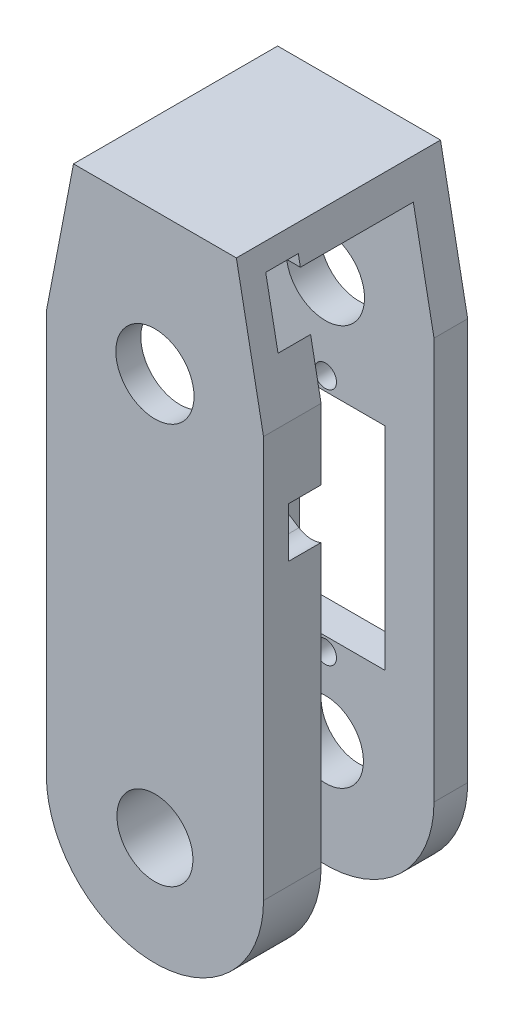
from build123d import *

# Parameters (mm, degrees)
SKETCH1_R           = 4.572
SKETCH1_R_2         = 4.445
BOSS_EXTRUDE1_DEPTH = 6.731
BOSS_EXTRUDE3_START = -13.208
SKETCH1_5_R         = 4.572
SKETCH1_5_R_2       = 1.2954
SKETCH1_5_R_3       = 4.445
SKETCH1_5_W         = 13.97
SKETCH1_5_H         = 24.765
BOSS_EXTRUDE3_DEPTH = 3.937
SKETCH4_R           = 1.7
CUT_EXTRUDE4_DEPTH  = 3.81
BOSS_EXTRUDE5_DEPTH = 16.4211
BOSS_EXTRUDE6_DEPTH = 4.572


with BuildPart() as part:
    # Sketch1 (on Front Plane) → Boss-Extrude1 (new body)
    with BuildSketch(Plane.XY):
        with BuildLine():
            Line((-12.7, 0), (-9.525, 16.51))
            Line((-9.525, 16.51), (9.525, 16.51))
            Line((9.525, 16.51), (12.7, 0))
            Line((12.7, 0), (12.7, -46.99))
            ThreePointArc((12.7, -46.99), (0, -59.69), (-12.7, -46.99))
            Line((-12.7, -46.99), (-12.7, 0))
        make_face()
        Circle(SKETCH1_R, mode=Mode.SUBTRACT)
        with Locations((0, -46.99)):
            Circle(SKETCH1_R_2, mode=Mode.SUBTRACT)
    extrude(amount=BOSS_EXTRUDE1_DEPTH)

    # Sketch4 → Cut-Extrude4 (cut)
    with BuildSketch(Plane(origin=(0, 0, 0), x_dir=(-1, 0, 0), z_dir=(0, 0, -1))):
        with BuildLine():
            Line((12.7, -14.099075092), (12.7, 0))
            Line((12.7, 0), (11.302104433, 7.269056948))
            Line((11.302104433, 7.269056948), (10.037418608, 13.84542324))
            Line((10.037418608, 13.84542324), (1.021082558, 8.023816422))
            ThreePointArc((1.021082558, 8.023816422), (0, 7.408645479), (-1.021082558, 8.023816422))
            Line((-1.021082558, 8.023816422), (-10.037418608, 13.84542324))
            Line((-10.037418608, 13.84542324), (-11.47556666, 6.367053366))
            Line((-11.47556666, 6.367053366), (-8.023816422, 1.021082558))
            ThreePointArc((-8.023816422, 1.021082558), (-7.408645479, 0), (-8.023816422, -1.021082558))
            Line((-8.023816422, -1.021082558), (-12.7, -8.263420264))
            Line((-12.7, -8.263420264), (-12.7, -14.099075092))
            ThreePointArc((-12.7, -14.099075092), (-11.380658922, -14.323016968), (-10.113003756, -13.894226547))
            Line((-10.113003756, -13.894226547), (-1.021082558, -8.023816422))
            ThreePointArc((-1.021082558, -8.023816422), (0, -7.408645479), (1.021082558, -8.023816422))
            Line((1.021082558, -8.023816422), (10.113003756, -13.894226547))
            ThreePointArc((10.113003756, -13.894226547), (11.380658922, -14.323016968), (12.7, -14.099075092))
        make_face()
        Circle(SKETCH4_R, mode=Mode.SUBTRACT)
    extrude(amount=-CUT_EXTRUDE4_DEPTH, mode=Mode.SUBTRACT)



with BuildPart() as body_2:
    # Sketch1<5> → Boss-Extrude3 (new body)
    with BuildSketch(Plane.XY.offset(BOSS_EXTRUDE3_START)):
        with BuildLine():
            Line((-12.7, 0), (-9.525, 16.51))
            Line((-9.525, 16.51), (9.525, 16.51))
            Line((9.525, 16.51), (12.7, 0))
            Line((12.7, 0), (12.7, -46.99))
            ThreePointArc((12.7, -46.99), (0, -59.69), (-12.7, -46.99))
            Line((-12.7, -46.99), (-12.7, 0))
        make_face()
        Circle(SKETCH1_5_R, mode=Mode.SUBTRACT)
        with Locations((0, -10.16)):
            Circle(SKETCH1_5_R_2, mode=Mode.SUBTRACT)
        with Locations((0, -38.1)):
            Circle(SKETCH1_5_R_2, mode=Mode.SUBTRACT)
        with Locations((0, -46.99)):
            Circle(SKETCH1_5_R_3, mode=Mode.SUBTRACT)
        with Locations((0, -24.13)):
            Rectangle(SKETCH1_5_W, SKETCH1_5_H, mode=Mode.SUBTRACT)
    extrude(amount=-BOSS_EXTRUDE3_DEPTH)


with BuildPart() as part_1:
    add(part.part)

    add(body_2.part)  # Boss-Extrude5 merges body 2
    # Sketch5 → Boss-Extrude5 (add)
    with BuildSketch(Plane(origin=(0, 0, 0), x_dir=(-1, 0, 0), z_dir=(0, 0, -1))):
        Polygon((-9.525, 16.51), (9.525, 16.51), (10.282115385, 12.573), (-10.282115385, 12.573), align=None)
    extrude(amount=BOSS_EXTRUDE5_DEPTH)

    # Sketch4<3> → Boss-Extrude6 (add)
    with BuildSketch(Plane(origin=(0, 0, 0), x_dir=(-1, 0, 0), z_dir=(0, 0, -1))):
        with BuildLine():
            Line((11.47556666, 6.367053366), (8.023816422, 1.021082558))
            ThreePointArc((8.023816422, 1.021082558), (7.408645479, 0), (8.023816422, -1.021082558))
            Line((8.023816422, -1.021082558), (12.7, -8.263420264))
            Line((12.7, -8.263420264), (12.7, 0))
            Line((12.7, 0), (11.47556666, 6.367053366))
        make_face()
    extrude(amount=-BOSS_EXTRUDE6_DEPTH)


solid = part_1.part
